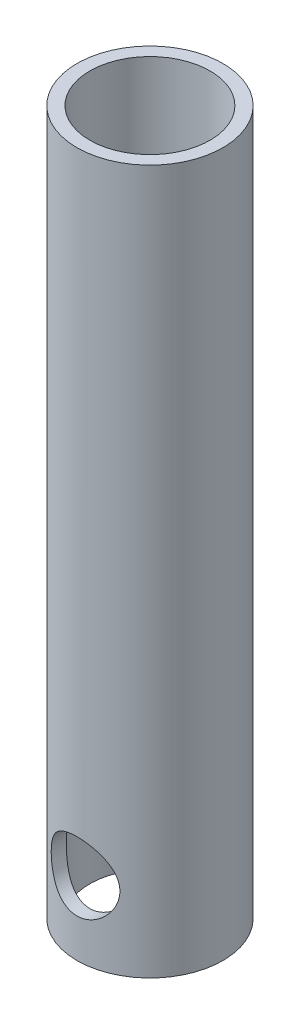
from build123d import *

# Parameters (mm, degrees)
SKETCH1_R               = 17
SKETCH1_R_2             = 14
BOSS_EXTRUDE1_DEPTH     = 164
CUT_EXTRUDE1_DEPTH      = 166.75282803
CUT_EXTRUDE1_DEPTH_BACK = 166.75282803
SKETCH2_R               = 8


with BuildPart() as part:
    # Sketch1 → Boss-Extrude1 (new body)
    with BuildSketch(Plane(origin=(0, 0, 0), x_dir=(1, 0, 0), z_dir=(0, 1, 0))):
        with Locations(Location((0, 0, 0), (0, 0, 270))):
            Circle(SKETCH1_R)
        with Locations(Location((0, 0, 0), (0, 0, 270))):
            Circle(SKETCH1_R_2, mode=Mode.SUBTRACT)
    extrude(amount=BOSS_EXTRUDE1_DEPTH)

    # Sketch2 → Cut-Extrude1 (cut, two sides: drawn at the far end of the back side and taken through both)
    with BuildSketch(Plane.XY.offset(-CUT_EXTRUDE1_DEPTH_BACK)):
        with Locations((0, 17)):
            Circle(SKETCH2_R)
    extrude(amount=CUT_EXTRUDE1_DEPTH + CUT_EXTRUDE1_DEPTH_BACK, mode=Mode.SUBTRACT)


solid = part.part
